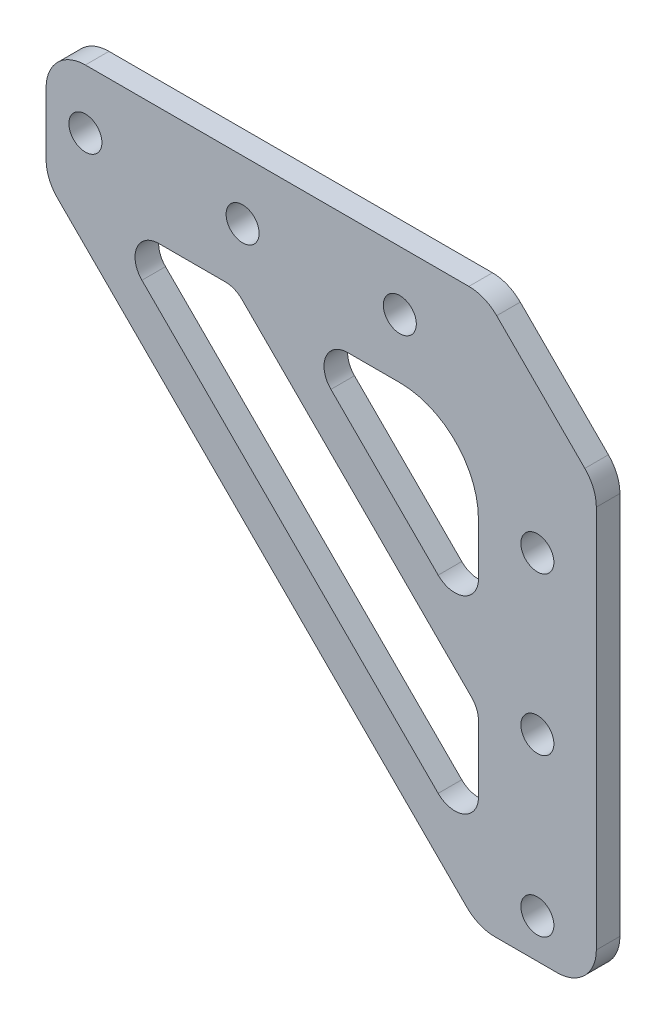
from build123d import *

# Parameters (mm, degrees)
SKETCH_1_R               = 2.1
EXTRUDE_1_DEPTH          = 3
EXTRUDE_2_DEPTH          = 3
CUT_EXTRUDE_1_DEPTH      = 100.040395799
CUT_EXTRUDE_1_DEPTH_BACK = 3
FILLET_1_R               = 5
EXTRUDE_3_DEPTH          = 3
FILLET_2_R               = 3
FILLET_3_R               = 10


with BuildPart() as part:
    # 草图1 → 凸台-拉伸1 (new body)
    with BuildSketch(Plane.XY):
        Polygon((0, 0), (-70, 0), (-70, -15), (-15, -15), (-15, -70), (0, -70), align=None)
        with Locations((-25, -7.5)):
            Circle(SKETCH_1_R, mode=Mode.SUBTRACT)
        with Locations(Location((-7.5, -25, 0), (0, 0, 180))):
            Circle(SKETCH_1_R, mode=Mode.SUBTRACT)
        with Locations((-45, -7.5)):
            Circle(SKETCH_1_R, mode=Mode.SUBTRACT)
        with Locations((-65, -7.5)):
            Circle(SKETCH_1_R, mode=Mode.SUBTRACT)
        with Locations(Location((-7.5, -65, 0), (0, 0, 180))):
            Circle(SKETCH_1_R, mode=Mode.SUBTRACT)
        with Locations(Location((-7.5, -45, 0), (0, 0, 180))):
            Circle(SKETCH_1_R, mode=Mode.SUBTRACT)
    extrude(amount=EXTRUDE_1_DEPTH)

    # 草图2 → 凸台-拉伸2 (add)
    with BuildSketch(Plane.XY.offset(3)):
        Polygon((-70, -15), (-15, -70), (-15, -62.928932188), (-62.928932188, -15), align=None)
    extrude(amount=-EXTRUDE_2_DEPTH)

    # 草图3 → 切除-拉伸1 (cut, two sides: drawn at the far end of the back side and taken through both)
    with BuildSketch(Plane.XY.offset(3).offset(-CUT_EXTRUDE_1_DEPTH_BACK)):
        Polygon((-147.863122604, 133.72098698), (-14.142135624, 0), (0, -14.142135624), (133.72098698, -147.863122604), (401.162960941, 119.578851357), (119.578851357, 401.162960941), align=None)
    extrude(amount=CUT_EXTRUDE_1_DEPTH + CUT_EXTRUDE_1_DEPTH_BACK, mode=Mode.SUBTRACT)

    # 圆角1
    fillet_1_edges = [part.edges().sort_by_distance(p)[0] for p in [
        (0, -70, 1.5),
        (-15, -70, 1.5),
        (-70, -15, 1.5),
        (-70, 0, 1.5),
        (-14.142135624, 0, 1.5),
        (0, -14.142135624, 1.5),
    ]]
    fillet(fillet_1_edges, radius=FILLET_1_R)

    # 草图4 → 凸台-拉伸3 (add, through all)
    with BuildSketch(Plane.XY.offset(3)):
        Polygon((-45.95836944, -15), (-15, -45.95836944), (-15, -38.887301628), (-38.887301628, -15), align=None)
    extrude(amount=-EXTRUDE_3_DEPTH)

    # 圆角2
    fillet_2_edges = [part.edges().sort_by_distance(p)[0] for p in [
        (-45.95836944, -15, 1.5),
        (-38.887301628, -15, 1.5),
        (-15, -38.887301628, 1.5),
        (-15, -45.95836944, 1.5),
        (-62.928932188, -15, 1.5),
        (-15, -62.928932188, 1.5),
    ]]
    fillet(fillet_2_edges, radius=FILLET_2_R)

    # 圆角3
    fillet_3_edges = [part.edges().sort_by_distance(p)[0] for p in [
        (-15, -15, 1.5),
    ]]
    fillet(fillet_3_edges, radius=FILLET_3_R)


solid = part.part
